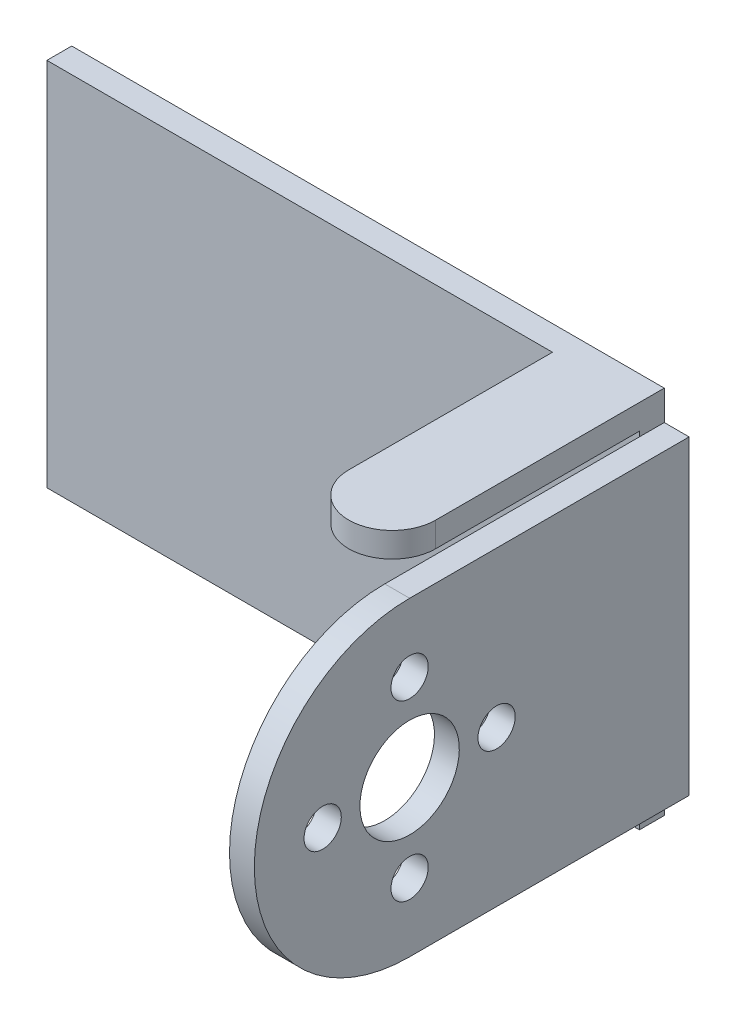
from build123d import *

# Parameters (mm, degrees)
SKETCH_1_W          = 47.7
SKETCH_1_H          = 29.8
EXTRUDE_1_DEPTH     = 2
SKETCH_2_W          = 7
SKETCH_2_H          = 2
EXTRUDE_3_DEPTH     = 19.9
CUT_EXTRUDE_1_DEPTH = 43.676369339
SKETCH_4_R          = 4
SKETCH_4_R_2        = 1.5
EXTRUDE_4_DEPTH     = 2
SKETCH_5_R          = 4
SKETCH_5_R_2        = 1.5
EXTRUDE_5_DEPTH     = 2


with BuildPart() as part:
    # 스케치1 → 보스-돌출1 (new body)
    with BuildSketch(Plane.XY):
        Rectangle(SKETCH_1_W, SKETCH_1_H)
    extrude(amount=EXTRUDE_1_DEPTH)

    # 스케치2 → 보스-돌출3 (add)
    with BuildSketch(Plane.XY.offset(2)):
        with Locations((20.35, 13.9)):
            Rectangle(SKETCH_2_W, SKETCH_2_H)
    extrude(amount=EXTRUDE_3_DEPTH)

    # 스케치3 → 컷-돌출1 (cut, through all)
    with BuildSketch(Plane.XZ.offset(-12.9)):
        with BuildLine():
            Line((16.85, 21.9), (16.85, 18.4))
            ThreePointArc((16.85, 18.4), (17.875126266, 20.874873734), (20.35, 21.9))
            Line((20.35, 21.9), (16.85, 21.9))
        make_face()
        with BuildLine():
            ThreePointArc((20.35, 21.9), (22.824873734, 20.874873734), (23.85, 18.4))
            Line((23.85, 18.4), (23.85, 21.9))
            Line((23.85, 21.9), (20.35, 21.9))
        make_face()
    extrude(amount=-CUT_EXTRUDE_1_DEPTH, mode=Mode.SUBTRACT)

    # 스케치4 → 보스-돌출4 (add)
    with BuildSketch(Plane(origin=(23.85, 0, 0), x_dir=(0, 0, -1), z_dir=(1, 0, 0))):
        with BuildLine():
            Line((0, 12.5), (0, -12.5))
            Line((0, -12.5), (-22.5, -12.5))
            ThreePointArc((-22.5, -12.5), (-35, 0), (-22.5, 12.5))
            Line((-22.5, 12.5), (0, 12.5))
        make_face()
        with Locations(Location((-22.5, 0, 0), (0, 0, 90))):
            Circle(SKETCH_4_R, mode=Mode.SUBTRACT)
        with Locations(Location((-29.5, 0, 0), (0, 0, 90))):
            Circle(SKETCH_4_R_2, mode=Mode.SUBTRACT)
        with Locations(Location((-22.5, 7, 0), (0, 0, 90))):
            Circle(SKETCH_4_R_2, mode=Mode.SUBTRACT)
        with Locations(Location((-15.5, 0, 0), (0, 0, 90))):
            Circle(SKETCH_4_R_2, mode=Mode.SUBTRACT)
        with Locations(Location((-22.5, -7, 0), (0, 0, 90))):
            Circle(SKETCH_4_R_2, mode=Mode.SUBTRACT)
    extrude(amount=EXTRUDE_4_DEPTH)

    # 스케치5 → 보스-돌출5 (add)
    with BuildSketch(Plane(origin=(23.85, 0, 0), x_dir=(0, 0, -1), z_dir=(1, 0, 0))):
        with BuildLine():
            Line((0, 12.5), (-22.5, 12.5))
            ThreePointArc((-22.5, 12.5), (-35, 0), (-22.5, -12.5))
            Line((-22.5, -12.5), (0, -12.5))
            Line((0, -12.5), (0, 12.5))
        make_face()
        with Locations(Location((-22.5, 0, 0), (0, 0, 90))):
            Circle(SKETCH_5_R, mode=Mode.SUBTRACT)
        with Locations(Location((-15.5, 0, 0), (0, 0, 90))):
            Circle(SKETCH_5_R_2, mode=Mode.SUBTRACT)
        with Locations(Location((-22.5, -7, 0), (0, 0, 90))):
            Circle(SKETCH_5_R_2, mode=Mode.SUBTRACT)
        with Locations(Location((-29.5, 0, 0), (0, 0, 90))):
            Circle(SKETCH_5_R_2, mode=Mode.SUBTRACT)
        with Locations(Location((-22.5, 7, 0), (0, 0, 90))):
            Circle(SKETCH_5_R_2, mode=Mode.SUBTRACT)
    extrude(amount=EXTRUDE_5_DEPTH)


solid = part.part
